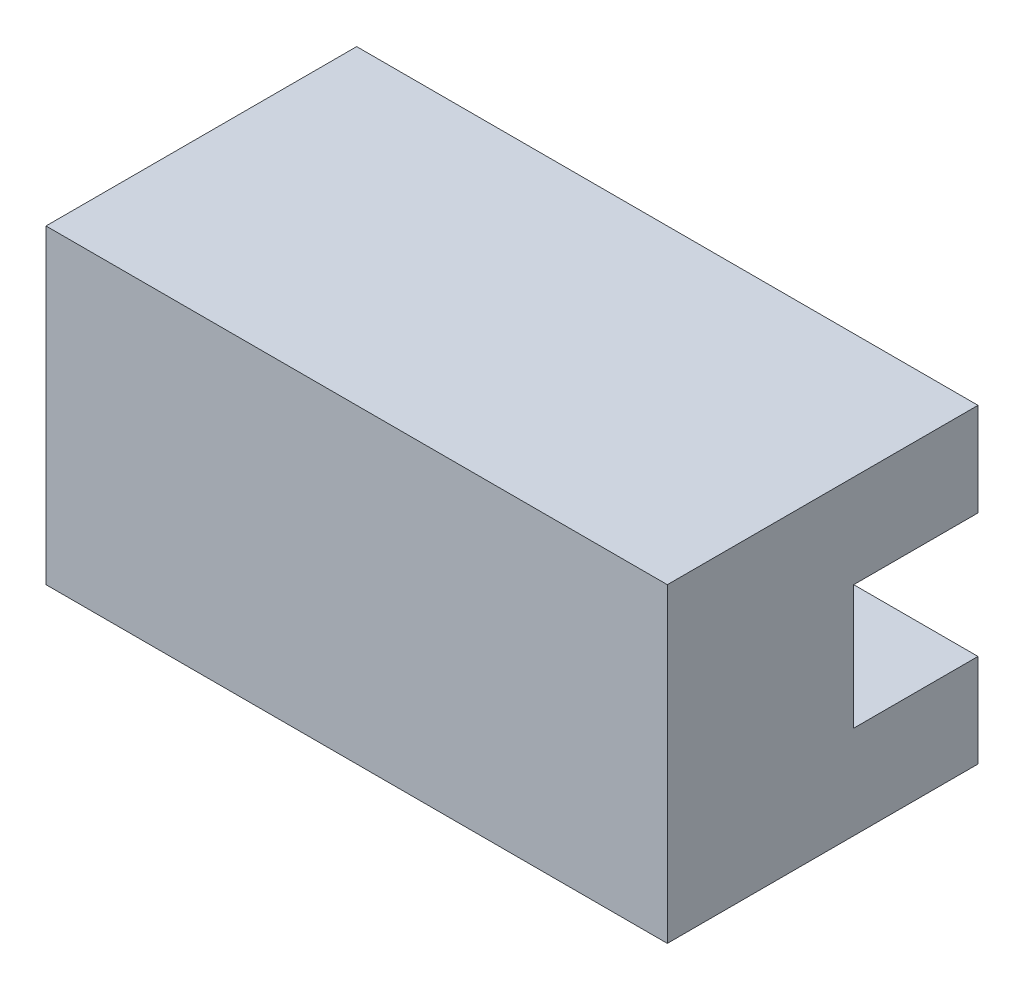
from build123d import *

# Parameters (mm, degrees)
SKETCH1_W           = 200
SKETCH1_H           = 100
BOSS_EXTRUDE1_DEPTH = 100
SKETCH3_W           = 40
SKETCH3_H           = 40
CUT_EXTRUDE1_DEPTH  = 200


with BuildPart() as part:
    # Sketch1 → Boss-Extrude1 (new body)
    with BuildSketch(Plane(origin=(0, 0, 0), x_dir=(1, 0, 0), z_dir=(0, 1, 0))):
        Rectangle(SKETCH1_W, SKETCH1_H)
    extrude(amount=BOSS_EXTRUDE1_DEPTH)

    # Sketch3 → Cut-Extrude1 (cut)
    with BuildSketch(Plane(origin=(100, 0, 0), x_dir=(0, 0, -1), z_dir=(1, 0, 0))):
        with Locations((30, 50)):
            Rectangle(SKETCH3_W, SKETCH3_H)
    extrude(amount=-CUT_EXTRUDE1_DEPTH, mode=Mode.SUBTRACT)


solid = part.part
